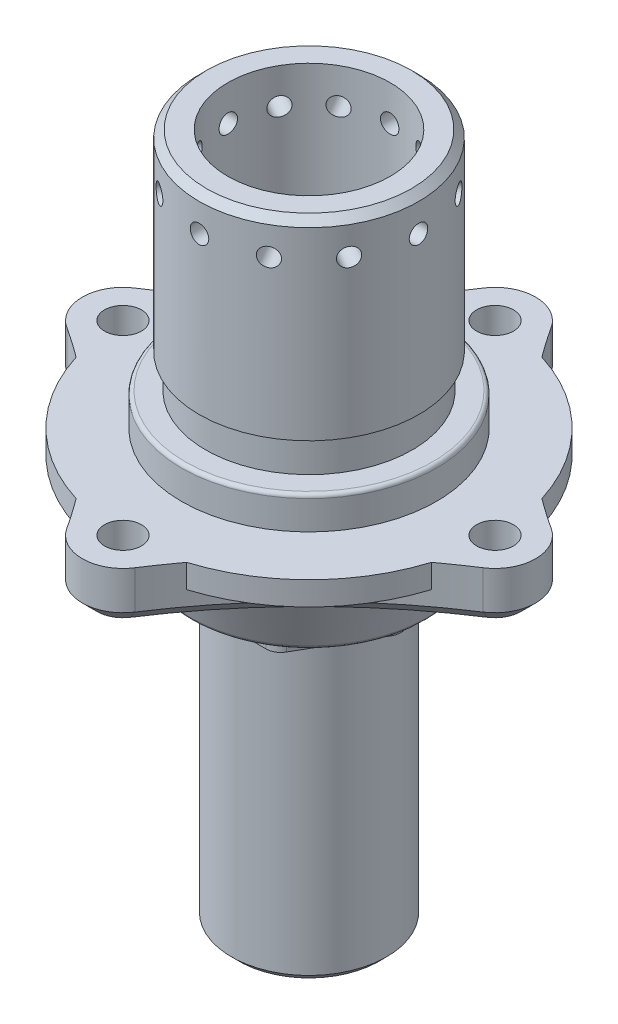
from build123d import *

# Parameters (mm, degrees)
DRIVE_PIN_HOLES_D             = 7.9375
DRIVE_PIN_HOLES_PATTERN_COUNT = 4
FLANGE_START                  = -6.35
SKETCH8_R                     = 52.3875
FLANGE_SUPPORT_CUT_DEPTH      = 6.35
SKETCH9_R                     = 52.3875
FLORAL_PATTERN_CUT_DEPTH      = 115.037412638
SKETCH10_R                    = 25.0825
BRAKE_HAT_HEX_DEPTH           = 4.7625
F_5_16_CLEARANCE_HOLE1_D      = 8.2042
BRAKE_HAT_FILLET_R            = 3.175
HUB_FILLET_R                  = 0.79375
SKETCH14_R                    = 1.984375
PIN_HOLES_DEPTH               = 106.850958068
PIN_HOLE_PATTERN_COUNT        = 12
FLORAL_PATTERN_CHAMFER_SIZE   = 3.175
FLANGE_FILLET_R               = 1.27
CUT_EXTRUDE1_DEPTH            = 19.05


with BuildPart() as part:
    # Sketch1 → Bearing Shaft/Flange Support (revolve)
    with BuildSketch(Plane(origin=(0, 0, 0), x_dir=(0, 0, -1), z_dir=(1, 0, 0)), mode=Mode.PRIVATE) as bearing_shaft_flange_support_sk:
        Polygon((0, 0), (-29.479347783, 0), (-25.0825, -12.08024), (-25.0825, -16.84274), (-16.66875, -16.84274), (-16.66875, -78.75524), (-15.08125, -80.34274), (0, -80.34274), align=None)
    revolve(bearing_shaft_flange_support_sk.sketch.rotate(Axis((0, 0, 0), (0, 1, 0)), 180), axis=Axis((0, 0, 0), (0, 1, 0)))

    # Sketch2 → Drive Pin Support (revolve)
    with BuildSketch(Plane(origin=(0, 0, 0), x_dir=(0, 0, -1), z_dir=(1, 0, 0)), mode=Mode.PRIVATE) as drive_pin_support_sk:
        Polygon((0, 0), (-52.3875, 0), (-52.3875, 11.43), (-27.4096, 11.43), (-27.4096, 18.43), (-22.225, 18.43), (-22.225, 25.7175), (-23.61946, 25.7175), (-23.61946, 65.405), (-22.03196, 66.9925), (0, 66.9925), align=None)
    revolve(drive_pin_support_sk.sketch.rotate(Axis((0, 0, 0), (0, 1, 0)), 180), axis=Axis((0, 0, 0), (0, 1, 0)))

    # Sketch5 → Center Mass Removal (revolve, cut)
    with BuildSketch(Plane(origin=(0, 0, 0), x_dir=(0, 0, -1), z_dir=(1, 0, 0)), mode=Mode.PRIVATE) as center_mass_removal_sk:
        Polygon((0, 66.9925), (17.4625, 66.9925), (17.4625, 19.3675), (12.7, -12.3825), (0, -12.3825), align=None)
    revolve(center_mass_removal_sk.sketch.rotate(Axis((0, 0, 0), (0, -1, 0)), 180), axis=Axis((0, 0, 0), (0, -1, 0)), mode=Mode.SUBTRACT)

    # Drive Pin Holes (through all)
    with Locations(Plane(origin=(0, 0, 0), x_dir=(-1, 0, 0), z_dir=(0, -1, 0))):
        with Locations((0, -40)):
            drive_pin_holes = Hole(DRIVE_PIN_HOLES_D / 2)

    # Drive Pin Holes Pattern: Drive Pin Holes ×4 about axis
    drive_pin_holes_pattern_axis = Axis((0, 0, 0), (0, 1, 0))
    for i in range(1, DRIVE_PIN_HOLES_PATTERN_COUNT):
        add(drive_pin_holes.rotate(drive_pin_holes_pattern_axis, i * 360 / DRIVE_PIN_HOLES_PATTERN_COUNT), mode=Mode.SUBTRACT)

    # Sketch8 → Flange Support Cut (cut)
    with BuildSketch(Plane.XZ.offset(FLANGE_START)):
        with Locations(Location((0, 0, 0), (0, 0, 270))):
            Circle(SKETCH8_R)
        with BuildLine():
            ThreePointArc((-7.324939653, -44.751840238), (0, -48.73125), (7.324939653, -44.751840238))
            ThreePointArc((7.324939653, -44.751840238), (24.066955211, -24.066955211), (44.751840238, -7.324939653))
            ThreePointArc((44.751840238, -7.324939653), (48.73125, 0), (44.751840238, 7.324939653))
            ThreePointArc((44.751840238, 7.324939653), (24.066955211, 24.066955211), (7.324939653, 44.751840238))
            ThreePointArc((7.324939653, 44.751840238), (0, 48.73125), (-7.324939653, 44.751840238))
            ThreePointArc((-7.324939653, 44.751840238), (-24.066955211, 24.066955211), (-44.751840238, 7.324939653))
            ThreePointArc((-44.751840238, 7.324939653), (-48.73125, 0), (-44.751840238, -7.324939653))
            ThreePointArc((-44.751840238, -7.324939653), (-24.066955211, -24.066955211), (-7.324939653, -44.751840238))
        make_face(mode=Mode.SUBTRACT)
    extrude(amount=FLANGE_SUPPORT_CUT_DEPTH, mode=Mode.SUBTRACT)

    # Sketch9 → Floral Pattern Cut (cut, through all)
    with BuildSketch(Plane.XZ.offset(-6.35)):
        Circle(SKETCH9_R)
        with BuildLine():
            ThreePointArc((-44.751840238, -7.324939653), (-48.73125, 0), (-44.751840238, 7.324939653))
            ThreePointArc((-44.751840238, 7.324939653), (-41.438222117, 9.549299756), (-38.196131944, 11.876679018))
            ThreePointArc((-38.196131944, 11.876679018), (-28.284271247, 28.284271247), (-11.876679018, 38.196131944))
            ThreePointArc((-11.876679018, 38.196131944), (-9.549299756, 41.438222117), (-7.324939653, 44.751840238))
            ThreePointArc((-7.324939653, 44.751840238), (0, 48.73125), (7.324939653, 44.751840238))
            ThreePointArc((7.324939653, 44.751840238), (9.549299756, 41.438222117), (11.876679018, 38.196131944))
            ThreePointArc((11.876679018, 38.196131944), (28.284271247, 28.284271247), (38.196131944, 11.876679018))
            ThreePointArc((38.196131944, 11.876679018), (41.438222117, 9.549299756), (44.751840238, 7.324939653))
            ThreePointArc((44.751840238, 7.324939653), (48.73125, 0), (44.751840238, -7.324939653))
            ThreePointArc((44.751840238, -7.324939653), (41.438222117, -9.549299756), (38.196131944, -11.876679018))
            ThreePointArc((38.196131944, -11.876679018), (28.284271247, -28.284271247), (11.876679018, -38.196131944))
            ThreePointArc((11.876679018, -38.196131944), (9.549299756, -41.438222117), (7.324939653, -44.751840238))
            ThreePointArc((7.324939653, -44.751840238), (0, -48.73125), (-7.324939653, -44.751840238))
            ThreePointArc((-7.324939653, -44.751840238), (-9.549299756, -41.438222117), (-11.876679018, -38.196131944))
            ThreePointArc((-11.876679018, -38.196131944), (-28.284271247, -28.284271247), (-38.196131944, -11.876679018))
            ThreePointArc((-38.196131944, -11.876679018), (-41.438222117, -9.549299756), (-44.751840238, -7.324939653))
        make_face(mode=Mode.SUBTRACT)
    extrude(amount=-FLORAL_PATTERN_CUT_DEPTH, mode=Mode.SUBTRACT)

    # Sketch10 → Brake Hat Hex (cut)
    with BuildSketch(Plane.XZ.offset(16.84274)):
        Circle(SKETCH10_R)
        Polygon((10.102509651, -17.49806), (20.205019303, 0), (10.102509651, 17.49806), (-10.102509651, 17.49806), (-20.205019303, 0), (-10.102509651, -17.49806), align=None, mode=Mode.SUBTRACT)
    extrude(amount=-BRAKE_HAT_HEX_DEPTH, mode=Mode.SUBTRACT)

    # 5/16 Clearance Hole1 (through all)
    with Locations(Plane(origin=(0, -80.34274, 0), x_dir=(-1, 0, 0), z_dir=(0, -1, 0))):
        with Locations((0, 0)):
            Hole(F_5_16_CLEARANCE_HOLE1_D / 2)

    # Brake Hat Fillet
    brake_hat_fillet_edges = [part.edges().sort_by_distance(p)[0] for p in [
        (-10.102509651, -14.46149, -17.49806),
        (-20.205019303, -14.46149, 0),
        (-10.102509651, -14.46149, 17.49806),
        (10.102509651, -14.46149, 17.49806),
        (20.205019303, -14.46149, 0),
        (10.102509651, -14.46149, -17.49806),
    ]]
    fillet(brake_hat_fillet_edges, radius=BRAKE_HAT_FILLET_R)

    # Hub Fillet
    hub_fillet_edges = [part.edges().sort_by_distance(p)[0] for p in [
        (0, 18.43, 27.4096),
    ]]
    fillet(hub_fillet_edges, radius=HUB_FILLET_R)

    # Sketch14 → Pin Holes (cut, through all)
    with BuildSketch(Plane(origin=(0, 0, 0), x_dir=(0, 0, -1), z_dir=(1, 0, 0))):
        with Locations((0, 59.3725)):
            Circle(SKETCH14_R)
    pin_holes = extrude(amount=-PIN_HOLES_DEPTH, mode=Mode.SUBTRACT)

    # Pin Hole Pattern: Pin Holes ×12 about axis
    pin_hole_pattern_axis = Axis((0, 66.9925, 0), (0, 1, 0))
    for i in range(1, PIN_HOLE_PATTERN_COUNT):
        add(pin_holes.rotate(pin_hole_pattern_axis, i * 360 / PIN_HOLE_PATTERN_COUNT), mode=Mode.SUBTRACT)

    # Floral Pattern Chamfer
    floral_pattern_chamfer_edges = [part.edges().sort_by_distance(p)[0] for p in [
        (0, 0, -48.73125),
        (48.73125, 0, 0),
        (0, 0, 48.73125),
        (-48.73125, 0, 0),
        (-24.066955211, 0, -24.066955211),
        (-24.066955211, 0, 24.066955211),
        (24.066955211, 0, 24.066955211),
        (24.066955211, 0, -24.066955211),
    ]]
    chamfer(floral_pattern_chamfer_edges, length=FLORAL_PATTERN_CHAMFER_SIZE)

    # Flange Fillet
    flange_fillet_edges = [part.edges().sort_by_distance(p)[0] for p in [
        (0, -12.08024, 25.0825),
    ]]
    fillet(flange_fillet_edges, radius=FLANGE_FILLET_R)

    # Sketch16 → Cut-Extrude1 (cut)
    with BuildSketch(Plane.XZ.offset(80.34274)):
        with BuildLine():
            Line((-2.921, 9.51127411), (-2.921, 8.152506302))
            ThreePointArc((-2.921, 8.152506302), (-3.314038524, 8.000796752), (-3.699233582, 7.830151397))
            Line((-3.699233582, 7.830151397), (-4.660027513, 8.790945329))
            ThreePointArc((-4.660027513, 8.790945329), (-4.82730795, 8.873848284), (-5.010628987, 8.8385065))
            ThreePointArc((-5.010628987, 8.8385065), (-7.184204897, 7.184204897), (-8.8385065, 5.010628987))
            ThreePointArc((-8.8385065, 5.010628987), (-8.873848284, 4.82730795), (-8.790945329, 4.660027513))
            Line((-8.790945329, 4.660027513), (-7.830151397, 3.699233582))
            ThreePointArc((-7.830151397, 3.699233582), (-8.000796752, 3.314038524), (-8.152506302, 2.921))
            Line((-8.152506302, 2.921), (-9.51127411, 2.921))
            ThreePointArc((-9.51127411, 2.921), (-9.688180483, 2.86133611), (-9.792817617, 2.706718147))
            ThreePointArc((-9.792817617, 2.706718147), (-10.16, 0), (-9.792817617, -2.706718147))
            ThreePointArc((-9.792817617, -2.706718147), (-9.688180483, -2.86133611), (-9.51127411, -2.921))
            Line((-9.51127411, -2.921), (-8.152506302, -2.921))
            ThreePointArc((-8.152506302, -2.921), (-8.000796752, -3.314038524), (-7.830151397, -3.699233582))
            Line((-7.830151397, -3.699233582), (-8.790945329, -4.660027513))
            ThreePointArc((-8.790945329, -4.660027513), (-8.873848284, -4.82730795), (-8.8385065, -5.010628987))
            ThreePointArc((-8.8385065, -5.010628987), (-7.184204897, -7.184204897), (-5.010628987, -8.8385065))
            ThreePointArc((-5.010628987, -8.8385065), (-4.82730795, -8.873848284), (-4.660027513, -8.790945329))
            Line((-4.660027513, -8.790945329), (-3.699233582, -7.830151397))
            ThreePointArc((-3.699233582, -7.830151397), (-3.314038524, -8.000796752), (-2.921, -8.152506302))
            Line((-2.921, -8.152506302), (-2.921, -9.51127411))
            ThreePointArc((-2.921, -9.51127411), (-2.86133611, -9.688180483), (-2.706718147, -9.792817617))
            ThreePointArc((-2.706718147, -9.792817617), (0, -10.16), (2.706718147, -9.792817617))
            ThreePointArc((2.706718147, -9.792817617), (2.86133611, -9.688180483), (2.921, -9.51127411))
            Line((2.921, -9.51127411), (2.921, -8.152506302))
            ThreePointArc((2.921, -8.152506302), (3.314038524, -8.000796752), (3.699233582, -7.830151397))
            Line((3.699233582, -7.830151397), (4.660027513, -8.790945329))
            ThreePointArc((4.660027513, -8.790945329), (4.82730795, -8.873848284), (5.010628987, -8.8385065))
            ThreePointArc((5.010628987, -8.8385065), (7.184204897, -7.184204897), (8.8385065, -5.010628987))
            ThreePointArc((8.8385065, -5.010628987), (8.873848284, -4.82730795), (8.790945329, -4.660027513))
            Line((8.790945329, -4.660027513), (7.830151397, -3.699233582))
            ThreePointArc((7.830151397, -3.699233582), (8.000796752, -3.314038524), (8.152506302, -2.921))
            Line((8.152506302, -2.921), (9.51127411, -2.921))
            ThreePointArc((9.51127411, -2.921), (9.688180483, -2.86133611), (9.792817617, -2.706718147))
            ThreePointArc((9.792817617, -2.706718147), (10.16, 0), (9.792817617, 2.706718147))
            ThreePointArc((9.792817617, 2.706718147), (9.688180483, 2.86133611), (9.51127411, 2.921))
            Line((9.51127411, 2.921), (8.152506302, 2.921))
            ThreePointArc((8.152506302, 2.921), (8.000796752, 3.314038524), (7.830151397, 3.699233582))
            Line((7.830151397, 3.699233582), (8.790945329, 4.660027513))
            ThreePointArc((8.790945329, 4.660027513), (8.873848284, 4.82730795), (8.8385065, 5.010628987))
            ThreePointArc((8.8385065, 5.010628987), (7.184204897, 7.184204897), (5.010628987, 8.8385065))
            ThreePointArc((5.010628987, 8.8385065), (4.82730795, 8.873848284), (4.660027513, 8.790945329))
            Line((4.660027513, 8.790945329), (3.699233582, 7.830151397))
            ThreePointArc((3.699233582, 7.830151397), (3.314038524, 8.000796752), (2.921, 8.152506302))
            Line((2.921, 8.152506302), (2.921, 9.51127411))
            ThreePointArc((2.921, 9.51127411), (2.86133611, 9.688180483), (2.706718147, 9.792817617))
            ThreePointArc((2.706718147, 9.792817617), (0, 10.16), (-2.706718147, 9.792817617))
            ThreePointArc((-2.706718147, 9.792817617), (-2.86133611, 9.688180483), (-2.921, 9.51127411))
        make_face()
    extrude(amount=-CUT_EXTRUDE1_DEPTH, mode=Mode.SUBTRACT)


solid = part.part
